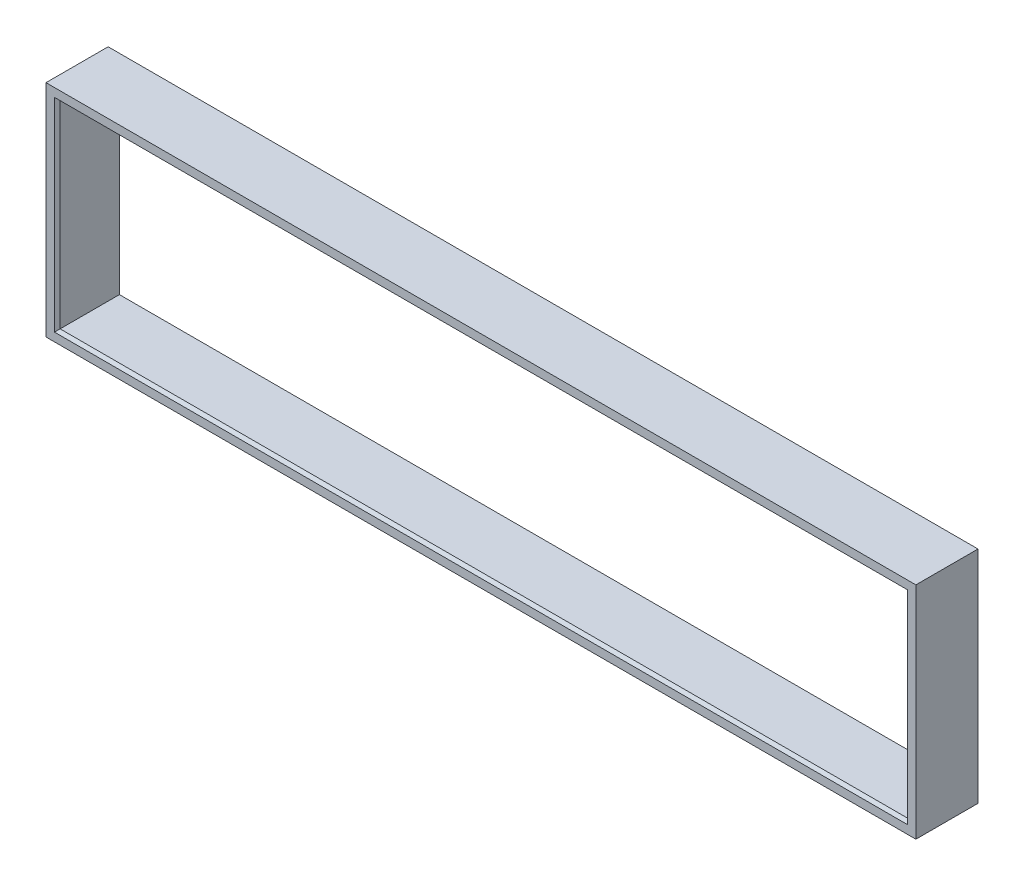
from build123d import *

# Parameters (mm, degrees)
EXTRUDE_1_DEPTH      = 2
EXTRUDE_1_DEPTH_BACK = 20
SKETCH_1_W           = 308
SKETCH_1_H           = 78
SKETCH_1_W_2         = 300
SKETCH_1_H_2         = 70
CHAMFER_1_SIZE       = 1


with BuildPart() as part:
    # Эскиз1 → Бобышка-Вытянуть1 (new, two sides: drawn at the far end of the back side and taken through both)
    with BuildSketch(Plane.XY.offset(-EXTRUDE_1_DEPTH_BACK)):
        Rectangle(SKETCH_1_W, SKETCH_1_H)
        Rectangle(SKETCH_1_W_2, SKETCH_1_H_2, mode=Mode.SUBTRACT)
    extrude(amount=EXTRUDE_1_DEPTH + EXTRUDE_1_DEPTH_BACK)

    # Фаска1
    chamfer_1_edges = [part.edges().sort_by_distance(p)[0] for p in [
        (-150, 0, 2),
        (0, -35, 2),
        (150, 0, 2),
        (0, 35, 2),
    ]]
    chamfer(chamfer_1_edges, length=CHAMFER_1_SIZE)


solid = part.part
